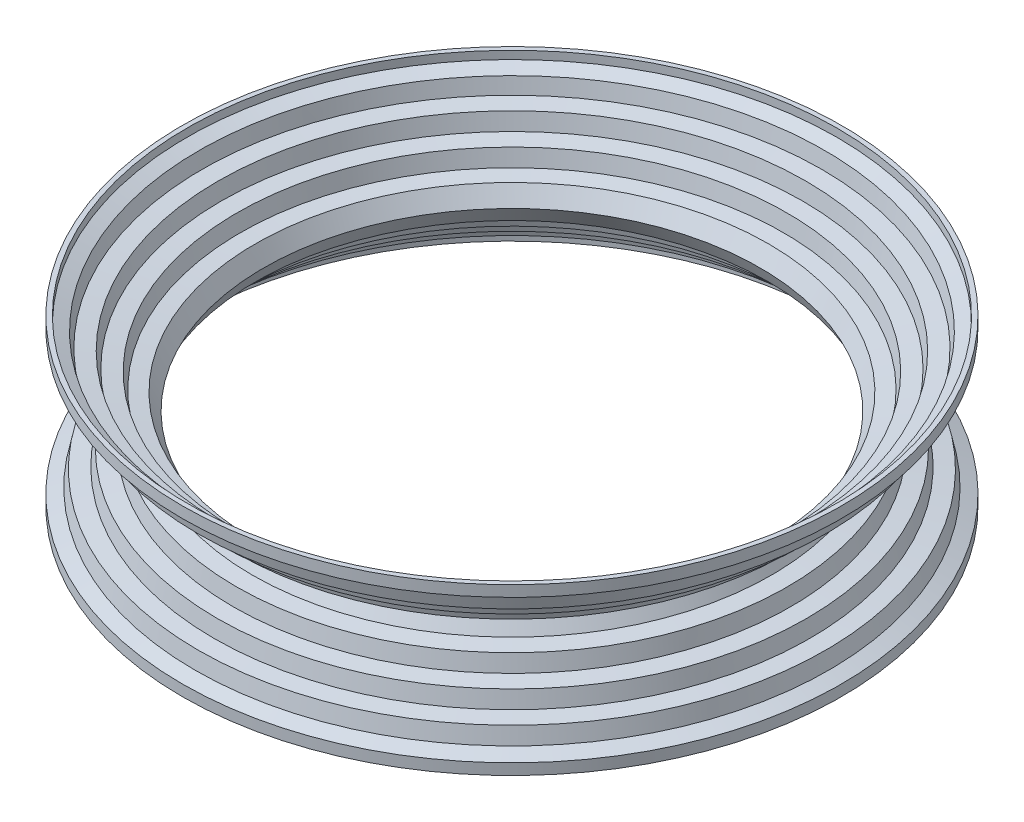
from build123d import *

# Parameters (mm, degrees)
SKETCH_1_R      = 35.893803705
EXTRUDE_1_DEPTH = 1.2
SHELL_1_T       = -0.5


with BuildPart() as part:
    # 스케치1 → 보스-돌출1 (new body)
    with BuildSketch(Plane(origin=(0, 0, 0), x_dir=(1, 0, 0), z_dir=(0, 1, 0))):
        with Locations(Location((0, 0, 0), (0, 0, 270))):
            Circle(SKETCH_1_R)
    extrude_1 = extrude(amount=EXTRUDE_1_DEPTH)

    # 스케치4 → 회전2 (revolve)
    with BuildSketch(Plane(origin=(0, 0, 0), x_dir=(0, 0, -1), z_dir=(1, 0, 0))):
        Polygon((0, 9), (-27.586355624, 9), (-28.280494739, 7.664375576), (-30.003805865, 7.417750835), (-30.357926555, 5.713279205), (-32.081237681, 5.466654464), (-32.435358371, 3.762182834), (-34.158669497, 3.515558093), (-34.512790188, 1.811086463), (-35.893803705, 1.2), (0, 1.2), align=None)
    revolve_2 = revolve(axis=Axis((0, 9, 0), (0, -1, 0)))

    # 대칭 복사1: 보스-돌출1, 회전2 across plane
    add(extrude_1.mirror(Plane(origin=(0, 9, 0), x_dir=(0, 0, 1), z_dir=(0, -1, 0))))
    add(revolve_2.mirror(Plane(origin=(0, 9, 0), x_dir=(0, 0, 1), z_dir=(0, -1, 0))))

    # 쉘1
    shell_1_openings = [part.faces().sort_by_distance(p)[0] for p in [
        (0, 18, 0),
        (0, 0, 0),
    ]]
    offset(amount=SHELL_1_T, openings=shell_1_openings, kind=Kind.INTERSECTION)


solid = part.part
